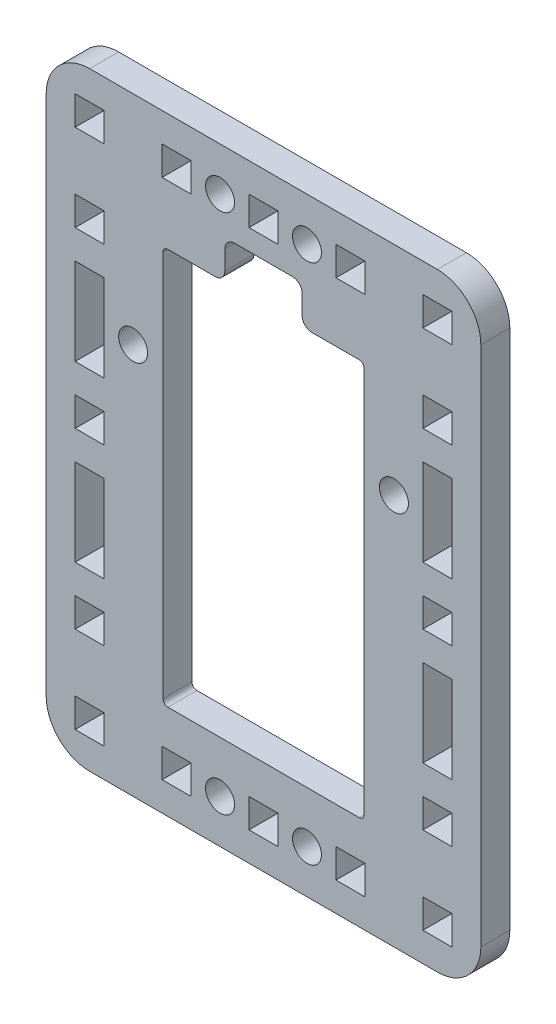
from build123d import *

# Parameters (mm, degrees)
MODEL_R                 = 1.5
MODEL_W                 = 3
MODEL_H                 = 3
MODEL_H_2               = 9
SALIENTE_EXTRUIR1_DEPTH = 3


with BuildPart() as part:
    # Model → Saliente-Extruir1 (new body)
    with BuildSketch(Plane.XY):
        with BuildLine():
            Line((14.191843711, 239.031739215), (14.191843711, 293.031739215))
            ThreePointArc((14.191843711, 293.031739215), (15.509863195, 296.213719731), (18.691843711, 297.531739215))
            Line((18.691843711, 297.531739215), (54.691843711, 297.531739215))
            ThreePointArc((54.691843711, 297.531739215), (57.873824226, 296.213719731), (59.191843711, 293.031739215))
            Line((59.191843711, 293.031739215), (59.191843711, 239.031739215))
            ThreePointArc((59.191843711, 239.031739215), (57.873824226, 235.8497587), (54.691843711, 234.531739215))
            Line((54.691843711, 234.531739215), (18.691843711, 234.531739215))
            ThreePointArc((18.691843711, 234.531739215), (15.509863195, 235.8497587), (14.191843711, 239.031739215))
        make_face()
        with Locations((32.191843711, 239.031739215)):
            Circle(MODEL_R, mode=Mode.SUBTRACT)
        with Locations((41.191843711, 239.031739215)):
            Circle(MODEL_R, mode=Mode.SUBTRACT)
        with Locations((32.191843711, 293.031739215)):
            Circle(MODEL_R, mode=Mode.SUBTRACT)
        with Locations((41.191843711, 293.031739215)):
            Circle(MODEL_R, mode=Mode.SUBTRACT)
        with Locations((50.191843711, 275.031739215)):
            Circle(MODEL_R, mode=Mode.SUBTRACT)
        with Locations((23.191843711, 275.031739215)):
            Circle(MODEL_R, mode=Mode.SUBTRACT)
        with Locations((18.691843711, 239.031739215)):
            Rectangle(MODEL_W, MODEL_H, mode=Mode.SUBTRACT)
        with Locations((18.691843711, 248.031739215)):
            Rectangle(MODEL_W, MODEL_H, mode=Mode.SUBTRACT)
        with Locations((18.691843711, 293.031739215)):
            Rectangle(MODEL_W, MODEL_H, mode=Mode.SUBTRACT)
        with Locations((54.691843711, 239.031739215)):
            Rectangle(MODEL_W, MODEL_H, mode=Mode.SUBTRACT)
        with Locations((54.691843711, 248.031739215)):
            Rectangle(MODEL_W, MODEL_H, mode=Mode.SUBTRACT)
        with Locations((54.691843711, 293.031739215)):
            Rectangle(MODEL_W, MODEL_H, mode=Mode.SUBTRACT)
        with Locations((45.691843711, 239.031739215)):
            Rectangle(MODEL_W, MODEL_H, mode=Mode.SUBTRACT)
        with Locations((45.691843711, 293.031739215)):
            Rectangle(MODEL_W, MODEL_H, mode=Mode.SUBTRACT)
        with Locations((18.691843711, 266.031739215)):
            Rectangle(MODEL_W, MODEL_H, mode=Mode.SUBTRACT)
        with Locations((18.691843711, 284.031739215)):
            Rectangle(MODEL_W, MODEL_H, mode=Mode.SUBTRACT)
        with Locations((54.691843711, 266.031739215)):
            Rectangle(MODEL_W, MODEL_H, mode=Mode.SUBTRACT)
        with Locations((54.691843711, 284.031739215)):
            Rectangle(MODEL_W, MODEL_H, mode=Mode.SUBTRACT)
        with Locations((36.691843711, 239.031739215)):
            Rectangle(MODEL_W, MODEL_H, mode=Mode.SUBTRACT)
        with Locations((36.691843711, 293.031739215)):
            Rectangle(MODEL_W, MODEL_H, mode=Mode.SUBTRACT)
        with Locations((27.691843711, 239.031739215)):
            Rectangle(MODEL_W, MODEL_H, mode=Mode.SUBTRACT)
        with Locations((27.691843711, 293.031739215)):
            Rectangle(MODEL_W, MODEL_H, mode=Mode.SUBTRACT)
        with Locations((18.691843711, 257.031739215)):
            Rectangle(MODEL_W, MODEL_H_2, mode=Mode.SUBTRACT)
        with Locations((54.691843711, 257.031739215)):
            Rectangle(MODEL_W, MODEL_H_2, mode=Mode.SUBTRACT)
        with Locations((18.691843711, 275.031739215)):
            Rectangle(MODEL_W, MODEL_H_2, mode=Mode.SUBTRACT)
        with Locations((54.691843711, 275.031739215)):
            Rectangle(MODEL_W, MODEL_H_2, mode=Mode.SUBTRACT)
        with BuildLine():
            Line((26.291843711, 284.881739215), (26.291843711, 244.831739215))
            ThreePointArc((26.291843711, 244.831739215), (26.43829032, 244.478185825), (26.791843711, 244.331739215))
            Line((26.791843711, 244.331739215), (46.591843711, 244.331739215))
            ThreePointArc((46.591843711, 244.331739215), (46.945397101, 244.478185825), (47.091843711, 244.831739215))
            Line((47.091843711, 244.831739215), (47.091843711, 284.881739215))
            ThreePointArc((47.091843711, 284.881739215), (46.945397101, 285.235292606), (46.591843711, 285.381739215))
            Line((46.591843711, 285.381739215), (41.691843711, 285.381739215))
            ThreePointArc((41.691843711, 285.381739215), (40.98473693, 285.674632434), (40.691843711, 286.381739215))
            Line((40.691843711, 286.381739215), (40.691843711, 288.381739215))
            ThreePointArc((40.691843711, 288.381739215), (40.398950492, 289.088845997), (39.691843711, 289.381739215))
            Line((39.691843711, 289.381739215), (33.691843711, 289.381739215))
            ThreePointArc((33.691843711, 289.381739215), (32.98473693, 289.088845997), (32.691843711, 288.381739215))
            Line((32.691843711, 288.381739215), (32.691843711, 286.381739215))
            ThreePointArc((32.691843711, 286.381739215), (32.398950492, 285.674632434), (31.691843711, 285.381739215))
            Line((31.691843711, 285.381739215), (26.791843711, 285.381739215))
            ThreePointArc((26.791843711, 285.381739215), (26.43829032, 285.235292606), (26.291843711, 284.881739215))
        make_face(mode=Mode.SUBTRACT)
    extrude(amount=SALIENTE_EXTRUIR1_DEPTH)


solid = part.part
